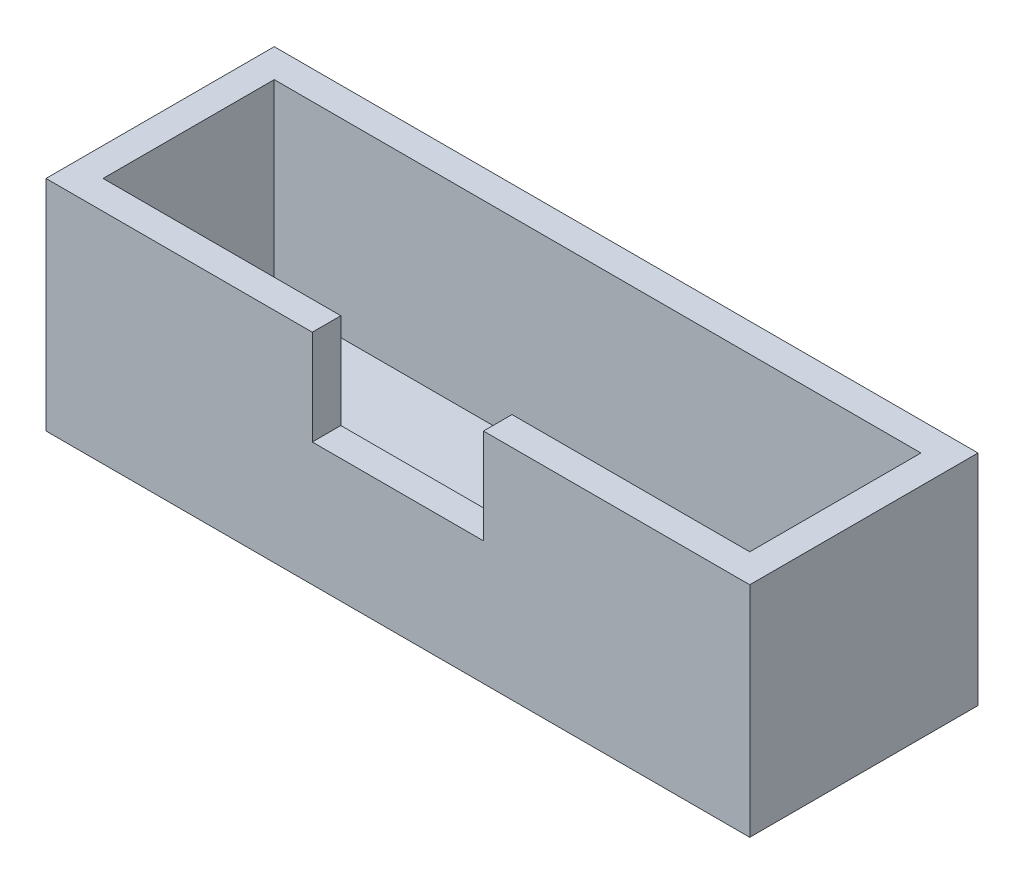
from build123d import *

# Parameters (mm, degrees)
SKETCH1_W           = 74
SKETCH1_H           = 24
SKETCH1_W_2         = 68
SKETCH1_H_2         = 18
BOSS_EXTRUDE1_DEPTH = 20
SKETCH1_3_W         = 74
SKETCH1_3_H         = 24
BOSS_EXTRUDE2_DEPTH = 3
CUT_EXTRUDE1_REACH  = 61.463
SKETCH4_W           = 18
SKETCH4_H           = 10


with BuildPart() as part:
    # Sketch1 → Boss-Extrude1 (new body)
    with BuildSketch(Plane(origin=(0, 0, 0), x_dir=(1, 0, 0), z_dir=(0, 1, 0))):
        with Locations((14.912280702, -12.336842105)):
            Rectangle(SKETCH1_W, SKETCH1_H)
        with Locations((14.912280702, -12.336842105)):
            Rectangle(SKETCH1_W_2, SKETCH1_H_2, mode=Mode.SUBTRACT)
    extrude(amount=BOSS_EXTRUDE1_DEPTH)

    # Sketch1<3> → Boss-Extrude2 (add)
    with BuildSketch(Plane(origin=(0, 0, 0), x_dir=(1, 0, 0), z_dir=(0, 1, 0))):
        with Locations((14.912280702, -12.336842105)):
            Rectangle(SKETCH1_3_W, SKETCH1_3_H)
    extrude(amount=-BOSS_EXTRUDE2_DEPTH)

    # Sketch4 → Cut-Extrude1 (cut, up to next)
    with BuildSketch(Plane(origin=(0, 0, 21.336842105), x_dir=(-1, 0, 0), z_dir=(0, 0, -1)), mode=Mode.PRIVATE) as cut_extrude1_sk1:
        with Locations((-14.912280702, 15)):
            Rectangle(SKETCH4_W, SKETCH4_H)
    cut_extrude1_tool1 = extrude(cut_extrude1_sk1.sketch, amount=-CUT_EXTRUDE1_REACH, mode=Mode.PRIVATE) & part.part
    add(cut_extrude1_tool1.solids().sort_by_distance((14.912281, 15, 21.336842))[0], mode=Mode.SUBTRACT)


solid = part.part
